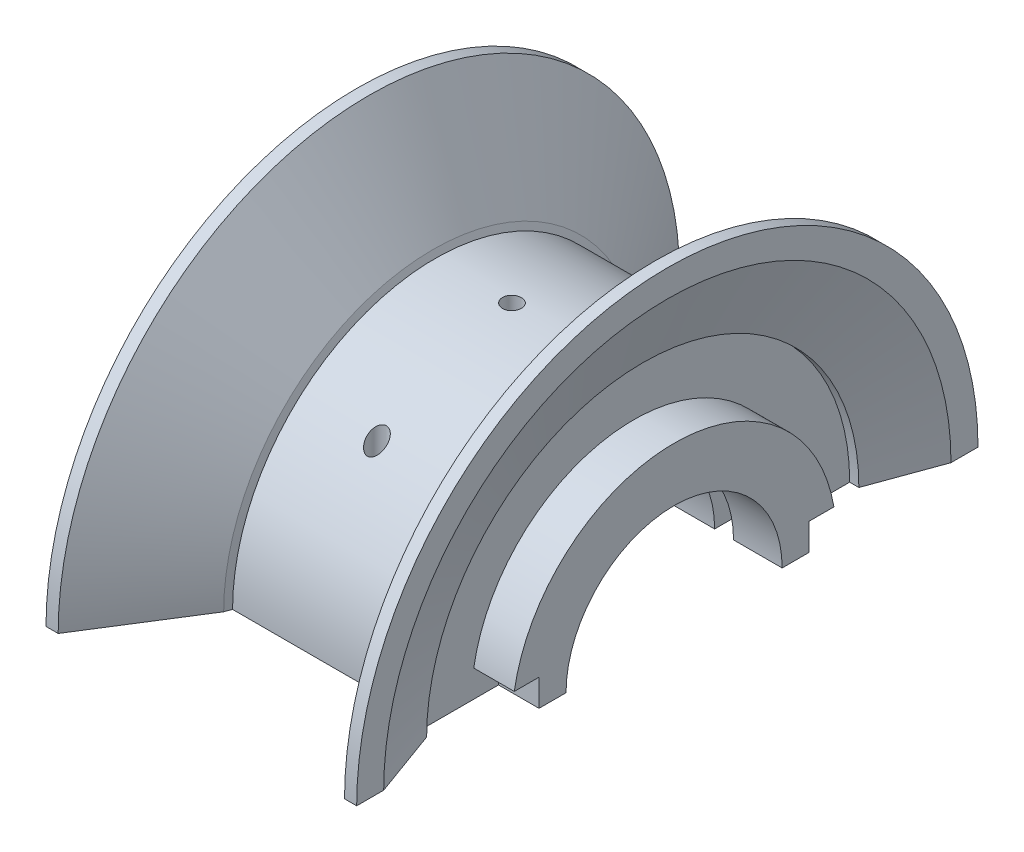
from build123d import *

# Parameters (mm, degrees)
PADSKE_R             = 6
PAD_DEPTH            = 6
HOLE_DEPTH           = 18.334935823
HOLE_DEPTH_BACK      = 18.334935823
HOLESKE_R            = 4
SCREWHOLE_DEPTH      = 18.334935823
SCREWHOLE_DEPTH_BACK = 18.334935823
SCREWHOLESKE_R       = 0.35
BOXSKE_W             = 7
BOXSKE_H             = 8
BOX_DEPTH            = 3.5
CUTSKE_W             = 26
CUTSKE_H             = 26
CUT_DEPTH            = 20
SCREWHOLE2SKE_R      = 0.35
SCREWHOLE2_DEPTH     = 18.334935823
SLOTSKE_W            = 1.5
SLOTSKE_H            = 1
SLOT_DEPTH           = 1
FLANGESLOTSKE_R      = 4.65
FLANGESLOT_DEPTH     = 0.7
EDGE_2_ANGLE         = 180
CHAMFER_2_SIZE       = 1
CHAMFER_2_SIZE2      = 4
CHAMFER2_SIZE        = 4
CHAMFER2_SIZE2       = 1


with BuildPart() as part:
    # BodySke → Body (revolve)
    with BuildSketch(Plane(origin=(0, 0, 0), x_dir=(1, 0, 0), z_dir=(0, 1, 0)), mode=Mode.PRIVATE) as body_sk:
        Polygon((4.5, 0), (4.5, 11.5), (4.3, 11.5), (2.298163712, 6), (-2.298163712, 6), (-4.3, 11.5), (-4.5, 11.5), (-4.5, 0), align=None)
    revolve(body_sk.sketch.rotate(Axis((-4.5, 0, 0), (1, 0, 0)), 180), axis=Axis((-4.5, 0, 0), (1, 0, 0)))

    # BoldSke → Bold (revolve)
    with BuildSketch(Plane(origin=(0, 0, 0), x_dir=(1, 0, 0), z_dir=(0, 1, 0)), mode=Mode.PRIVATE) as bold_sk:
        Polygon((-2.298163712, 6), (2.298163712, 6), (2.844119063, 7.5), (-2.844119063, 7.5), align=None)
    revolve(bold_sk.sketch.rotate(Axis((0, 0, 0), (1, 0, 0)), 180), axis=Axis((0, 0, 0), (1, 0, 0)))

    # PadSke → Pad (add, symmetric)
    with BuildSketch(Plane(origin=(0, 0, 0), x_dir=(0, 0, -1), z_dir=(1, 0, 0))):
        Circle(PADSKE_R)
    extrude(amount=PAD_DEPTH, both=True)

    # HoleSke → Hole (cut, two sides: drawn at the far end of the back side and taken through both)
    with BuildSketch(Plane(origin=(0, 0, 0), x_dir=(0, 0, -1), z_dir=(1, 0, 0)).offset(-HOLE_DEPTH_BACK)):
        Circle(HOLESKE_R)
    extrude(amount=HOLE_DEPTH + HOLE_DEPTH_BACK, mode=Mode.SUBTRACT)

    # ScrewHoleSke → ScrewHole (cut, two sides: drawn at the far end of the back side and taken through both)
    with BuildSketch(Plane(origin=(0, 0, 0), x_dir=(1, 0, 0), z_dir=(0, 1, 0)).offset(-SCREWHOLE_DEPTH_BACK)):
        with Locations(Location((0, 0, 0), (0, 0, 270))):
            Circle(SCREWHOLESKE_R)
    extrude(amount=SCREWHOLE_DEPTH + SCREWHOLE_DEPTH_BACK, mode=Mode.SUBTRACT)

    # BoxSke → Box (cut, symmetric)
    with BuildSketch(Plane.XY):
        Rectangle(BOXSKE_W, BOXSKE_H)
    extrude(amount=BOX_DEPTH, both=True, mode=Mode.SUBTRACT)

    # CutSke → Cut (cut)
    with BuildSketch(Plane(origin=(0, 0, 0), x_dir=(1, 0, 0), z_dir=(0, 1, 0))):
        Rectangle(CUTSKE_W, CUTSKE_H)
    extrude(amount=-CUT_DEPTH, mode=Mode.SUBTRACT)

    # ScrewHole2Ske → ScrewHole2 (cut, through all)
    with BuildSketch(Plane.XZ):
        with Locations(Location((0, -5, 0), (0, 0, 270))):
            Circle(SCREWHOLE2SKE_R)
        with Locations(Location((0, 5, 0), (0, 0, 270))):
            Circle(SCREWHOLE2SKE_R)
    extrude(amount=-SCREWHOLE2_DEPTH, mode=Mode.SUBTRACT)

    # SlotSke → Slot (cut)
    with BuildSketch(Plane.XZ):
        with Locations((-5.25, 5.5)):
            Rectangle(SLOTSKE_W, SLOTSKE_H)
        with Locations((5.25, 5.5)):
            Rectangle(SLOTSKE_W, SLOTSKE_H)
        with Locations((5.25, -5.5)):
            Rectangle(SLOTSKE_W, SLOTSKE_H)
        with Locations((-5.25, -5.5)):
            Rectangle(SLOTSKE_W, SLOTSKE_H)
    extrude(amount=-SLOT_DEPTH, mode=Mode.SUBTRACT)

    # FlangeSlotSke → FlangeSlot (cut)
    with BuildSketch(Plane(origin=(-3.5, 0, 0), x_dir=(0, 0, -1), z_dir=(1, 0, 0))):
        Circle(FLANGESLOTSKE_R)
    flangeslot = extrude(amount=-FLANGESLOT_DEPTH, mode=Mode.SUBTRACT)

    # FlangeSlot2: FlangeSlot across plane
    add(flangeslot.mirror(Plane(origin=(0, 0, 0), x_dir=(0, 0, 1), z_dir=(1, 0, 0))), mode=Mode.SUBTRACT)

    # EdgeSke → Edge 2 (revolve)
    with BuildSketch(Plane(origin=(0, 0, 0), x_dir=(1, 0, 0), z_dir=(0, 1, 0))):
        Polygon((4.5, 8), (4.840074414, 8), (5.75, 10.5), (5.75, 11.5), (4.5, 11.5), align=None)
        Polygon((-5.75, 11.5), (-4.5, 11.5), (-4.5, 8), (-4.840074414, 8), (-5.75, 10.5), align=None)
    revolve(axis=Axis((-4.5, 0, 0), (1, 0, 0)), revolution_arc=EDGE_2_ANGLE)

    # Chamfer 2
    chamfer_2_edges = [part.edges().sort_by_distance(p)[0] for p in [
        (4.3, 11.5, 0),
    ]]
    chamfer_2_side = [part.faces().sort_by_distance(p)[0] for p in [
        (4.4, 11.5, 0),
    ]]
    chamfer(chamfer_2_edges, length=CHAMFER_2_SIZE, length2=CHAMFER_2_SIZE2, reference=chamfer_2_side[0])

    # Chamfer2
    chamfer2_edges = [part.edges().sort_by_distance(p)[0] for p in [
        (-4.3, 11.5, 0),
    ]]
    chamfer2_side = [part.faces().sort_by_distance(p)[0] for p in [
        (-3.572059531, 9.5, 0),
    ]]
    chamfer(chamfer2_edges, length=CHAMFER2_SIZE, length2=CHAMFER2_SIZE2, reference=chamfer2_side[0])


solid = part.part
